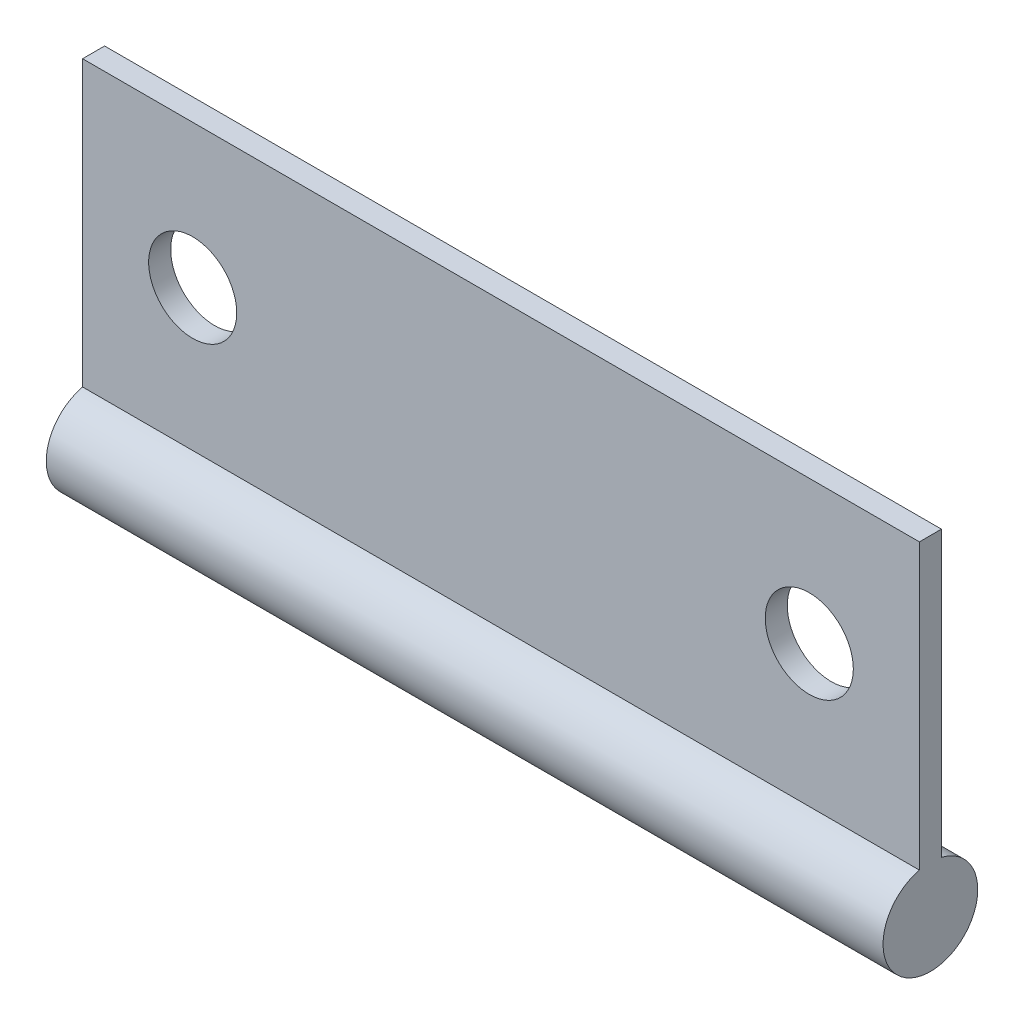
from build123d import *

# Parameters (mm, degrees)
SKETCH_1_W          = 38
SKETCH_1_H          = 30
SKETCH_1_R          = 2
EXTRUDE_1_DEPTH     = 1
SKETCH_2_W          = 38
SKETCH_2_H          = 15
CUT_EXTRUDE_1_DEPTH = 1
SKETCH_4_R          = 2.15
EXTRUDE_2_DEPTH     = 38


with BuildPart() as part:
    # 草图1 → 凸台-拉伸1 (new body)
    with BuildSketch(Plane.XY):
        with Locations((-26.818488663, 4.019613274)):
            Rectangle(SKETCH_1_W, SKETCH_1_H)
        with Locations((-40.818488663, 12.519613274)):
            Circle(SKETCH_1_R, mode=Mode.SUBTRACT)
        with Locations((-12.818488663, 12.519613274)):
            Circle(SKETCH_1_R, mode=Mode.SUBTRACT)
        with Locations((-40.818488663, -4.480386726)):
            Circle(SKETCH_1_R, mode=Mode.SUBTRACT)
        with Locations((-12.818488663, -4.480386726)):
            Circle(SKETCH_1_R, mode=Mode.SUBTRACT)
    extrude(amount=EXTRUDE_1_DEPTH)

    # 草图2 → 切除-拉伸1 (cut)
    with BuildSketch(Plane.XY.offset(1)):
        with Locations((-26.818488663, -3.480386726)):
            Rectangle(SKETCH_2_W, SKETCH_2_H)
    extrude(amount=-CUT_EXTRUDE_1_DEPTH, mode=Mode.SUBTRACT)

    # 草图4 → 凸台-拉伸2 (add)
    with BuildSketch(Plane.ZY.offset(45.818488663)):
        with Locations((0.5, 4.019613274)):
            Circle(SKETCH_4_R)
    extrude(amount=-EXTRUDE_2_DEPTH)


solid = part.part
